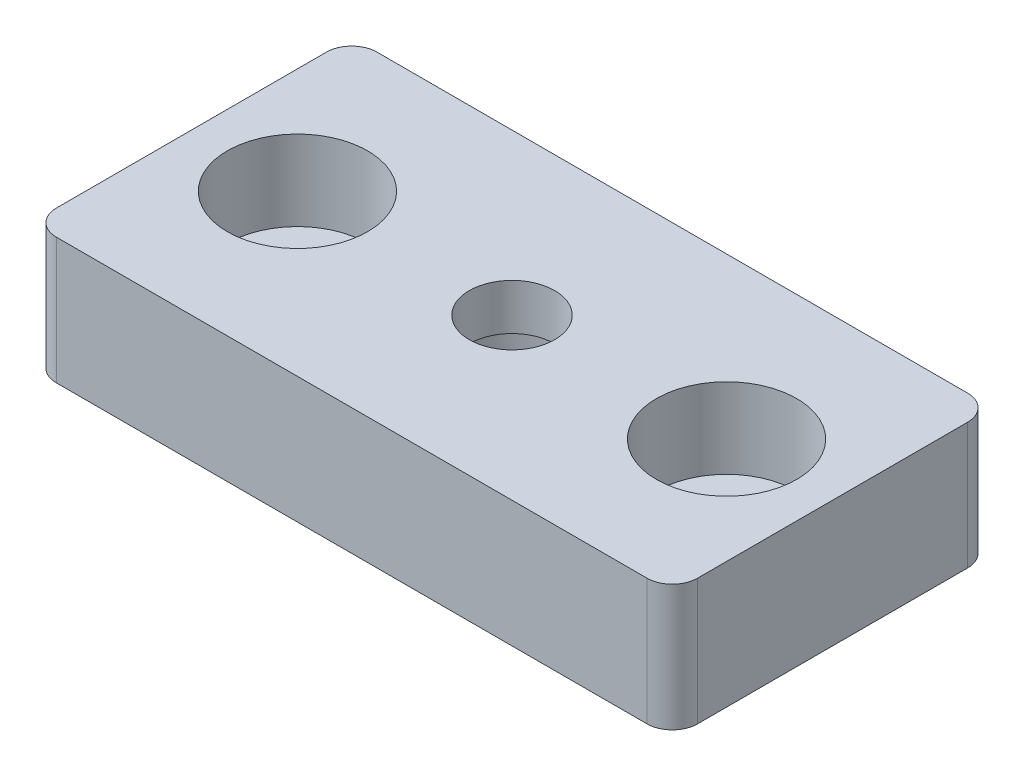
from build123d import *

# Parameters (mm, degrees)
SKETCH1_W                                        = 50.8
SKETCH1_H                                        = 25.4
BOSS_EXTRUDE1_DEPTH                              = 10
CBORE_FOR_1_4_SOCKET_HEAD_CAP_SCREW2_D           = 6.7564
CBORE_FOR_1_4_SOCKET_HEAD_CAP_SCREW2_CBORE_D     = 11.1125
CBORE_FOR_1_4_SOCKET_HEAD_CAP_SCREW2_CBORE_DEPTH = 6.35
CBORE_FOR_1_4_SOCKET_HEAD_CAP_SCREW3_D           = 6.7564
CBORE_FOR_1_4_SOCKET_HEAD_CAP_SCREW3_CBORE_D     = 11.1125
CBORE_FOR_1_4_SOCKET_HEAD_CAP_SCREW3_CBORE_DEPTH = 6.35
FILLET2_R                                        = 2


with BuildPart() as part:
    # Sketch1 → Boss-Extrude1 (new body)
    with BuildSketch(Plane(origin=(0, 0, 0), x_dir=(1, 0, 0), z_dir=(0, 1, 0))):
        with Locations((-10.671863118, -7.895247148)):
            Rectangle(SKETCH1_W, SKETCH1_H)
    extrude(amount=BOSS_EXTRUDE1_DEPTH)

    # CBORE for 1/4 Socket Head Cap Screw2 (through all)
    with Locations(Plane(origin=(0, 10, 0), x_dir=(1, 0, 0), z_dir=(0, 1, 0))):
        with Locations((-27.671863118, -7.895247148), (6.328136882, -7.895247148)):
            CounterBoreHole(CBORE_FOR_1_4_SOCKET_HEAD_CAP_SCREW2_D / 2, CBORE_FOR_1_4_SOCKET_HEAD_CAP_SCREW2_CBORE_D / 2, CBORE_FOR_1_4_SOCKET_HEAD_CAP_SCREW2_CBORE_DEPTH)

    # CBORE for 1/4 Socket Head Cap Screw3 (through all)
    with Locations(Plane(origin=(0, 0, 0), x_dir=(-1, 0, 0), z_dir=(0, -1, 0))):
        with Locations((10.671863118, -7.895247148)):
            CounterBoreHole(CBORE_FOR_1_4_SOCKET_HEAD_CAP_SCREW3_D / 2, CBORE_FOR_1_4_SOCKET_HEAD_CAP_SCREW3_CBORE_D / 2, CBORE_FOR_1_4_SOCKET_HEAD_CAP_SCREW3_CBORE_DEPTH)

    # Fillet2
    fillet2_edges = [part.edges().sort_by_distance(p)[0] for p in [
        (-36.071863118, 5, -4.804752852),
        (14.728136882, 5, -4.804752852),
        (14.728136882, 5, 20.595247148),
        (-36.071863118, 5, 20.595247148),
    ]]
    fillet(fillet2_edges, radius=FILLET2_R)


solid = part.part
